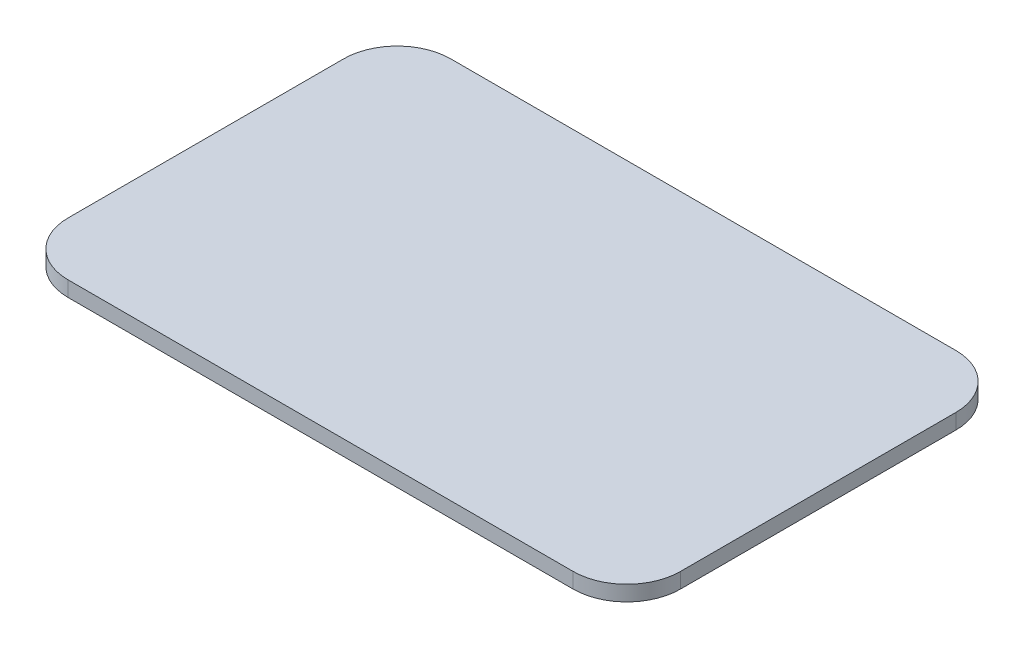
from build123d import *

# Parameters (mm, degrees)
SKETCH1_W           = 80
SKETCH1_H           = 50
BOSS_EXTRUDE1_DEPTH = 2
FILLET1_R           = 7


with BuildPart() as part:
    # Sketch1 → Boss-Extrude1 (new body)
    with BuildSketch(Plane(origin=(0, 0, 0), x_dir=(1, 0, 0), z_dir=(0, 1, 0))):
        Rectangle(SKETCH1_W, SKETCH1_H)
    extrude(amount=BOSS_EXTRUDE1_DEPTH)

    # Fillet1
    fillet1_edges = [part.edges().sort_by_distance(p)[0] for p in [
        (40, 1, 25),
        (-40, 1, 25),
        (-40, 1, -25),
        (40, 1, -25),
    ]]
    fillet(fillet1_edges, radius=FILLET1_R)


solid = part.part
